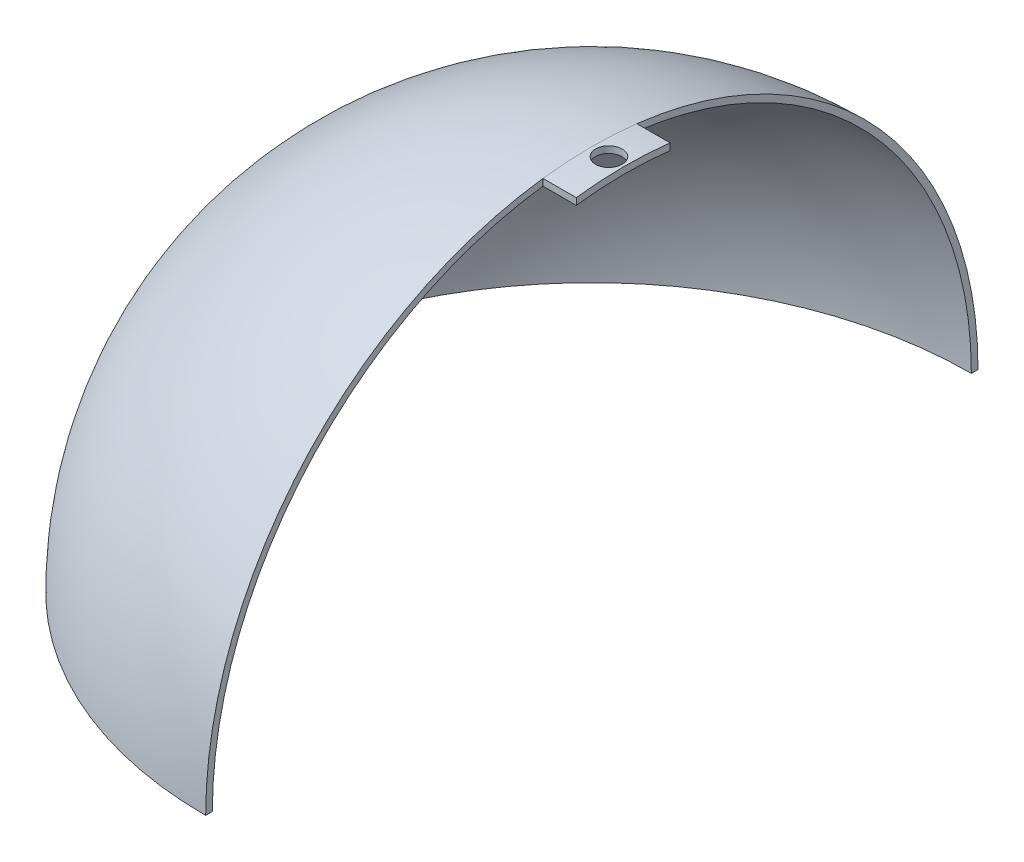
from build123d import *

# Parameters (mm, degrees)
REVOLVE1_ANGLE      = 90
BOSS_EXTRUDE1_DEPTH = 1000
SKETCH4_R           = 400
CUT_EXTRUDE1_DEPTH  = 1000


with BuildPart() as part:
    # Sketch1 → Revolve1 (revolve)
    with BuildSketch(Plane(origin=(0, 0, 0), x_dir=(1, 0, 0), z_dir=(0, 1, 0))):
        with BuildLine():
            Line((0, 11600), (0, 11400))
            ThreePointArc((0, 11400), (-11400, 0), (0, -11400))
            Line((0, -11400), (0, -11600))
            ThreePointArc((0, -11600), (-11600, 0), (0, 11600))
        make_face()
    revolve(axis=Axis((0, 0, 53.164398698), (0, 0, -1)), revolution_arc=REVOLVE1_ANGLE)

    # Sketch3 → Boss-Extrude1 (add)
    with BuildSketch(Plane(origin=(0, 0, 0), x_dir=(0, 0, -1), z_dir=(1, 0, 0))):
        with BuildLine():
            Line((-1467.86571595, 11506.75324494), (-1467.86571595, 11305.103725306))
            ThreePointArc((-1467.86571595, 11305.103725306), (-58.228635227, 11399.851289646), (1352.302778281, 11319.508699403))
            Line((1352.302778281, 11319.508699403), (1352.302778281, 11520.906092658))
            ThreePointArc((1352.302778281, 11520.906092658), (-58.213176475, 11599.853931239), (-1467.86571595, 11506.75324494))
        make_face()
    extrude(amount=BOSS_EXTRUDE1_DEPTH)

    # Sketch4 → Cut-Extrude1 (cut)
    with BuildSketch(Plane(origin=(0, 11600, 0), x_dir=(1, 0, 0), z_dir=(0, 1, 0))):
        with Locations(Location((514.293273851, 0, 0), (0, 0, 270))):
            Circle(SKETCH4_R)
    extrude(amount=-CUT_EXTRUDE1_DEPTH, mode=Mode.SUBTRACT)


solid = part.part
